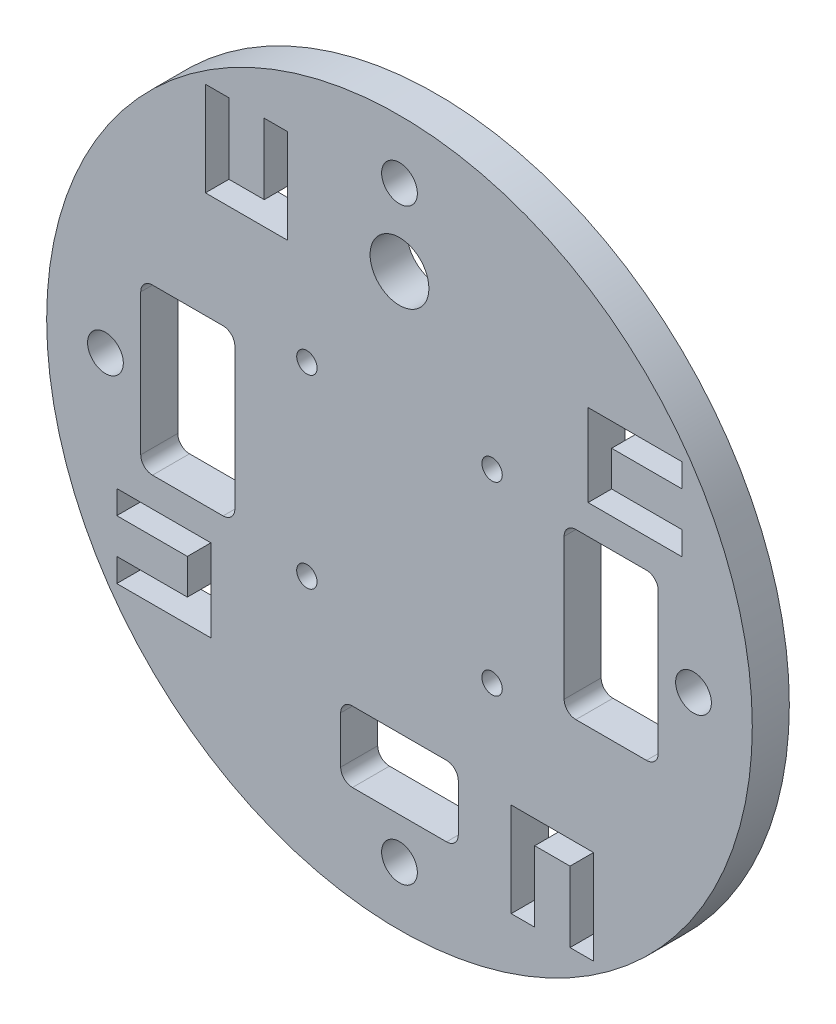
from build123d import *

# Parameters (mm, degrees)
SKETCH1_R               = 38.1
BOSS_EXTRUDE1_DEPTH     = 4
SKETCH2_R               = 1.1
CUT_EXTRUDE1_DEPTH      = 55.029806589
CUT_EXTRUDE2_DEPTH      = 55.029806589
CUT_EXTRUDE2_DEPTH_BACK = 55.029806589
SKETCH3_R               = 1.9304
CUT_EXTRUDE3_DEPTH      = 55.029806589
CUT_EXTRUDE3_DEPTH_BACK = 55.029806589
CUT_EXTRUDE4_REACH      = 56.03
SKETCH5_R               = 3.175
CUT_EXTRUDE5_REACH      = 56.03


with BuildPart() as part:
    # Sketch1 → Boss-Extrude1 (new body)
    with BuildSketch(Plane.XY):
        Circle(SKETCH1_R)
    extrude(amount=BOSS_EXTRUDE1_DEPTH)

    # Sketch2 → Cut-Extrude1 (cut, through all)
    with BuildSketch(Plane.XY.offset(4)):
        with Locations((10, 10)):
            Circle(SKETCH2_R)
        with Locations((10, -10)):
            Circle(SKETCH2_R)
        with Locations((-10, -10)):
            Circle(SKETCH2_R)
        with Locations((-10, 10)):
            Circle(SKETCH2_R)
    extrude(amount=-CUT_EXTRUDE1_DEPTH, mode=Mode.SUBTRACT)

    # Sketch3 → Cut-Extrude2 (cut, two sides: drawn at the far end of the back side and taken through both)
    with BuildSketch(Plane.XY.offset(4).offset(-CUT_EXTRUDE2_DEPTH_BACK)):
        with Locations((0, -31.75)):
            Circle(SKETCH3_R)
        with Locations((-31.75, 0)):
            Circle(SKETCH3_R)
        with Locations((0, 31.75)):
            Circle(SKETCH3_R)
        with Locations((31.75, 0)):
            Circle(SKETCH3_R)
    extrude(amount=CUT_EXTRUDE2_DEPTH + CUT_EXTRUDE2_DEPTH_BACK, mode=Mode.SUBTRACT)

    # Sketch4 → Cut-Extrude3 (cut, two sides: drawn at the far end of the back side and taken through both)
    with BuildSketch(Plane.XY.offset(4).offset(-CUT_EXTRUDE3_DEPTH_BACK)):
        with BuildLine():
            Line((-19.05, -8.89), (-26.67, -8.89))
            ThreePointArc((-26.67, -8.89), (-27.568025612, -8.518025612), (-27.94, -7.62))
            Line((-27.94, -7.62), (-27.94, 7.62))
            ThreePointArc((-27.94, 7.62), (-27.568025612, 8.518025612), (-26.67, 8.89))
            Line((-26.67, 8.89), (-19.05, 8.89))
            ThreePointArc((-19.05, 8.89), (-18.151974388, 8.518025612), (-17.78, 7.62))
            Line((-17.78, 7.62), (-17.78, -7.62))
            ThreePointArc((-17.78, -7.62), (-18.151974388, -8.518025612), (-19.05, -8.89))
        make_face()
        with BuildLine():
            Line((19.05, 8.89), (26.67, 8.89))
            ThreePointArc((26.67, 8.89), (27.568025612, 8.518025612), (27.94, 7.62))
            Line((27.94, 7.62), (27.94, -7.62))
            ThreePointArc((27.94, -7.62), (27.568025612, -8.518025612), (26.67, -8.89))
            Line((26.67, -8.89), (19.05, -8.89))
            ThreePointArc((19.05, -8.89), (18.151974388, -8.518025612), (17.78, -7.62))
            Line((17.78, -7.62), (17.78, 7.62))
            ThreePointArc((17.78, 7.62), (18.151974388, 8.518025612), (19.05, 8.89))
        make_face()
    extrude(amount=CUT_EXTRUDE3_DEPTH + CUT_EXTRUDE3_DEPTH_BACK, mode=Mode.SUBTRACT)

    # Sketch5 → Cut-Extrude4 (cut, up to next)
    with BuildSketch(Plane.XY.offset(4), mode=Mode.PRIVATE) as cut_extrude4_sk1:
        with Locations((0, 23.495)):
            Circle(SKETCH5_R)
    cut_extrude4_tool1 = extrude(cut_extrude4_sk1.sketch, amount=-CUT_EXTRUDE4_REACH, mode=Mode.PRIVATE) & part.part
    # Sketch5 → Cut-Extrude4 (cut, up to next)
    with BuildSketch(Plane.XY.offset(4), mode=Mode.PRIVATE) as cut_extrude4_sk2:
        with BuildLine():
            Line((-5.08, -27.305), (5.08, -27.305))
            ThreePointArc((5.08, -27.305), (5.978025612, -26.933025612), (6.35, -26.035))
            Line((6.35, -26.035), (6.35, -20.955))
            ThreePointArc((6.35, -20.955), (5.978025612, -20.056974388), (5.08, -19.685))
            Line((5.08, -19.685), (-5.08, -19.685))
            ThreePointArc((-5.08, -19.685), (-5.978025612, -20.056974388), (-6.35, -20.955))
            Line((-6.35, -20.955), (-6.35, -26.035))
            ThreePointArc((-6.35, -26.035), (-5.978025612, -26.933025612), (-5.08, -27.305))
        make_face()
    cut_extrude4_tool2 = extrude(cut_extrude4_sk2.sketch, amount=-CUT_EXTRUDE4_REACH, mode=Mode.PRIVATE) & part.part
    add(cut_extrude4_tool1.solids().sort_by_distance((0, 23.495, 4))[0], mode=Mode.SUBTRACT)
    add(cut_extrude4_tool2.solids().sort_by_distance((0, -23.495, 4))[0], mode=Mode.SUBTRACT)

    # Sketch6 → Cut-Extrude5 (cut, up to next)
    with BuildSketch(Plane.XY.offset(4), mode=Mode.PRIVATE) as cut_extrude5_sk1:
        Polygon((-18.415, 22.90700482), (-14.605, 22.90700482), (-14.605, 30.52700482), (-12.065, 30.52700482), (-12.065, 20.36700482), (-20.955, 20.36700482), (-20.955, 30.52700482), (-18.415, 30.52700482), align=None)
    cut_extrude5_tool1 = extrude(cut_extrude5_sk1.sketch, amount=-CUT_EXTRUDE5_REACH, mode=Mode.PRIVATE) & part.part
    # Sketch6 → Cut-Extrude5 (cut, up to next)
    with BuildSketch(Plane.XY.offset(4), mode=Mode.PRIVATE) as cut_extrude5_sk2:
        Polygon((22.90700482, 18.415), (22.90700482, 14.605), (30.52700482, 14.605), (30.52700482, 12.065), (20.36700482, 12.065), (20.36700482, 20.955), (30.52700482, 20.955), (30.52700482, 18.415), align=None)
    cut_extrude5_tool2 = extrude(cut_extrude5_sk2.sketch, amount=-CUT_EXTRUDE5_REACH, mode=Mode.PRIVATE) & part.part
    # Sketch6 → Cut-Extrude5 (cut, up to next)
    with BuildSketch(Plane.XY.offset(4), mode=Mode.PRIVATE) as cut_extrude5_sk3:
        Polygon((18.415, -22.90700482), (14.605, -22.90700482), (14.605, -30.52700482), (12.065, -30.52700482), (12.065, -20.36700482), (20.955, -20.36700482), (20.955, -30.52700482), (18.415, -30.52700482), align=None)
    cut_extrude5_tool3 = extrude(cut_extrude5_sk3.sketch, amount=-CUT_EXTRUDE5_REACH, mode=Mode.PRIVATE) & part.part
    # Sketch6 → Cut-Extrude5 (cut, up to next)
    with BuildSketch(Plane.XY.offset(4), mode=Mode.PRIVATE) as cut_extrude5_sk4:
        Polygon((-22.90700482, -18.415), (-22.90700482, -14.605), (-30.52700482, -14.605), (-30.52700482, -12.065), (-20.36700482, -12.065), (-20.36700482, -20.955), (-30.52700482, -20.955), (-30.52700482, -18.415), align=None)
    cut_extrude5_tool4 = extrude(cut_extrude5_sk4.sketch, amount=-CUT_EXTRUDE5_REACH, mode=Mode.PRIVATE) & part.part
    add(cut_extrude5_tool1.solids().sort_by_distance((-16.51, 22.772002, 4))[0], mode=Mode.SUBTRACT)
    add(cut_extrude5_tool2.solids().sort_by_distance((22.772002, 16.51, 4))[0], mode=Mode.SUBTRACT)
    add(cut_extrude5_tool3.solids().sort_by_distance((16.51, -22.772002, 4))[0], mode=Mode.SUBTRACT)
    add(cut_extrude5_tool4.solids().sort_by_distance((-22.772002, -16.51, 4))[0], mode=Mode.SUBTRACT)


solid = part.part
